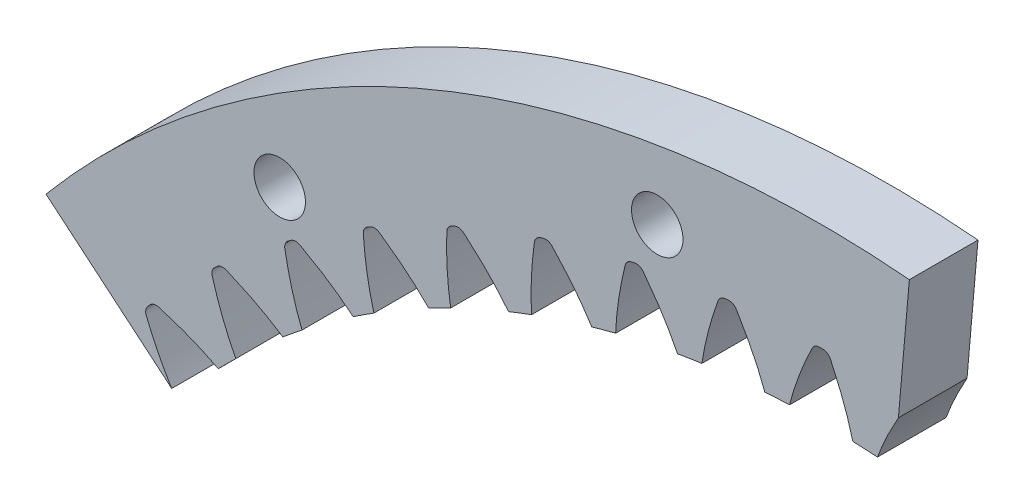
from build123d import *

# Parameters (mm, degrees)
SKETCHREVOLVESPURASSEMBLY01GEAR_W       = 4
SKETCHREVOLVESPURASSEMBLY01GEAR_H       = 10
TOOTHEXTRUDECUTSPURASSEMBLY01GEAR_DEPTH = 9.525
PATTERNSPURASSEMBLY01GEAR_COUNT         = 60
SKETCH_1_R                              = 1.5
CUT_EXTRUDE_1_DEPTH                     = 84.475566323


with BuildPart() as part:
    # SketchRevolveSpurAssembly01Gear → SpurAssembly01Gear (revolve)
    with BuildSketch(Plane(origin=(0, 0, 0), x_dir=(0, 0, -1), z_dir=(1, 0, 0))):
        with Locations((-1.525, 53.958333333)):
            Rectangle(SKETCHREVOLVESPURASSEMBLY01GEAR_W, SKETCHREVOLVESPURASSEMBLY01GEAR_H)
    revolve(axis=Axis((0, 0, 0), (0, 0, -1)))

    # SketchToothSpurAssembly01Gear → ToothExtrudeCutSpurAssembly01Gear (cut, symmetric)
    with BuildSketch(Plane.XY):
        with BuildLine():
            ThreePointArc((48.551075729, -1.931969744), (48.589499498, 0), (48.551075729, 1.931969744))
            add(Edge.make_bspline(
                [(48.551075729, 1.931969744), (48.754107955, 1.886986149), (49.069179316, 1.80891495), (49.501648873, 1.686308195), (49.85989049, 1.575736478), (50.239361507, 1.448912695), (50.639522752, 1.304870957), (51.059628707, 1.142293213), (51.499587014, 0.961388036), (51.956483674, 0.756289451), (52.292062007, 0.609699751), (52.488237209, 0.503788059), (52.543761393, 0.459846005), (52.592551774, 0.409506978), (52.633771551, 0.35272097), (52.666628648, 0.290756262), (52.698553231, 0.203550172), (52.709161206, 0.119137949), (52.708181814, 0.043946339), (52.708409093, 0), (52.708181814, -0.043946339), (52.709161206, -0.119137949), (52.698553231, -0.203550172), (52.666628648, -0.290756262), (52.633771551, -0.35272097), (52.592551774, -0.409506978), (52.543761393, -0.459846005), (52.488237209, -0.503788059), (52.292062007, -0.609699751), (51.956483674, -0.756289451), (51.499587014, -0.961388036), (51.059628707, -1.142293213), (50.639522752, -1.304870957), (50.239361507, -1.448912695), (49.85989049, -1.575736478), (49.501648873, -1.686308195), (49.069179316, -1.80891495), (48.754107955, -1.886986149), (48.551075729, -1.931969744)],
                knots=[0, 0, 0, 0, 0.065343735, 0.101972626, 0.141239534, 0.183144457, 0.227687397, 0.274868352, 0.324687324, 0.377144312, 0.432239316, 0.439737303, 0.447061088, 0.454384873, 0.461708658, 0.469032443, 0.476356228, 0.490794996, 0.4953975, 0.5, 0.5046025, 0.509205004, 0.523643772, 0.530967557, 0.538291342, 0.545615127, 0.552938912, 0.560262697, 0.567760684, 0.622855688, 0.675312676, 0.725131648, 0.772312603, 0.816855543, 0.858760466, 0.898027374, 0.934656265, 1, 1, 1, 1], degree=3))
        make_face()
    toothextrudecutspurassembly01gear = extrude(amount=TOOTHEXTRUDECUTSPURASSEMBLY01GEAR_DEPTH, both=True, mode=Mode.SUBTRACT)

    # PatternSpurAssembly01Gear: ToothExtrudeCutSpurAssembly01Gear ×60 about axis
    patternspurassembly01gear_axis = Axis((0, 0, 50), (0, 0, -1))
    for i in range(1, PATTERNSPURASSEMBLY01GEAR_COUNT):
        add(toothextrudecutspurassembly01gear.rotate(patternspurassembly01gear_axis, i * 360 / PATTERNSPURASSEMBLY01GEAR_COUNT), mode=Mode.SUBTRACT)

    # Эскиз1 → Вырез-Вытянуть1 (cut, through all)
    with BuildSketch(Plane.XY.offset(3.525)):
        with Locations((-9.550649772, 54.164426416)):
            Circle(SKETCH_1_R)
        with Locations((-31.546703999, 45.053362436)):
            Circle(SKETCH_1_R)
        with BuildLine():
            Line((0, 0), (6.972446493, 79.695428093))
            ThreePointArc((6.972446493, 79.695428093), (30.61461783, -73.910225572), (-61.28344183, 51.422913437))
            Line((-61.28344183, 51.422913437), (0, 0))
        make_face()
    extrude(amount=-CUT_EXTRUDE_1_DEPTH, mode=Mode.SUBTRACT)


solid = part.part
